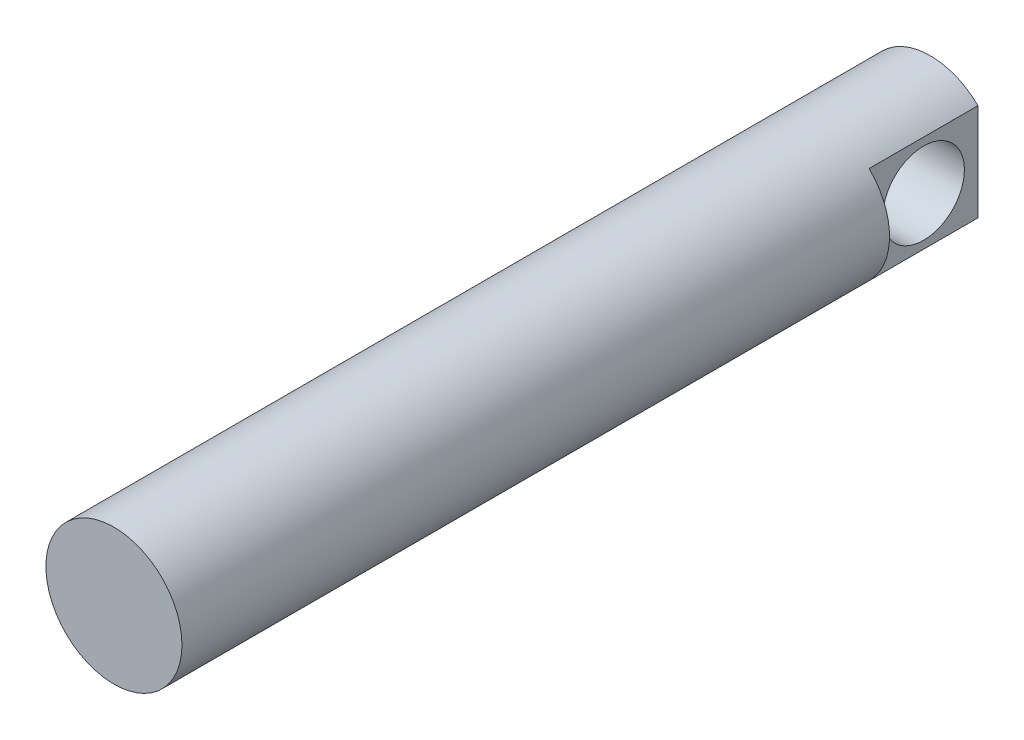
from build123d import *

# Parameters (mm, degrees)
ESQUISSE1_R                  = 10
BOSS_EXTRU_1_DEPTH           = 120
ENL_V_MAT_EXTRU_1_DEPTH      = 16
ENL_V_MAT_EXTRU_2_DEPTH      = 122.610032481
ENL_V_MAT_EXTRU_2_DEPTH_BACK = 122.610032481
ESQUISSE3_R                  = 6


with BuildPart() as part:
    # Esquisse1 → Boss.-Extru.1 (new body)
    with BuildSketch(Plane.XY):
        Circle(ESQUISSE1_R)
    extrude(amount=BOSS_EXTRU_1_DEPTH)

    # Esquisse2 → Enlèv. mat.-Extru.1 (cut)
    with BuildSketch(Plane(origin=(0, 0, 0), x_dir=(-1, 0, 0), z_dir=(0, 0, -1))):
        with BuildLine():
            Line((-7, 7.141428429), (-7, -7.141428429))
            ThreePointArc((-7, -7.141428429), (-10, 0), (-7, 7.141428429))
        make_face()
        with BuildLine():
            Line((7, 7.141428429), (7, -7.141428429))
            ThreePointArc((7, -7.141428429), (10, 0), (7, 7.141428429))
        make_face()
    extrude(amount=-ENL_V_MAT_EXTRU_1_DEPTH, mode=Mode.SUBTRACT)

    # Esquisse3 → Enlèv. mat.-Extru.2 (cut, two sides: drawn at the far end of the back side and taken through both)
    with BuildSketch(Plane(origin=(7, 0, 0), x_dir=(0, 0, -1), z_dir=(1, 0, 0)).offset(-ENL_V_MAT_EXTRU_2_DEPTH_BACK)):
        with Locations(Location((-8, 0, 0), (0, 0, 90))):
            Circle(ESQUISSE3_R)
    extrude(amount=ENL_V_MAT_EXTRU_2_DEPTH + ENL_V_MAT_EXTRU_2_DEPTH_BACK, mode=Mode.SUBTRACT)


solid = part.part
